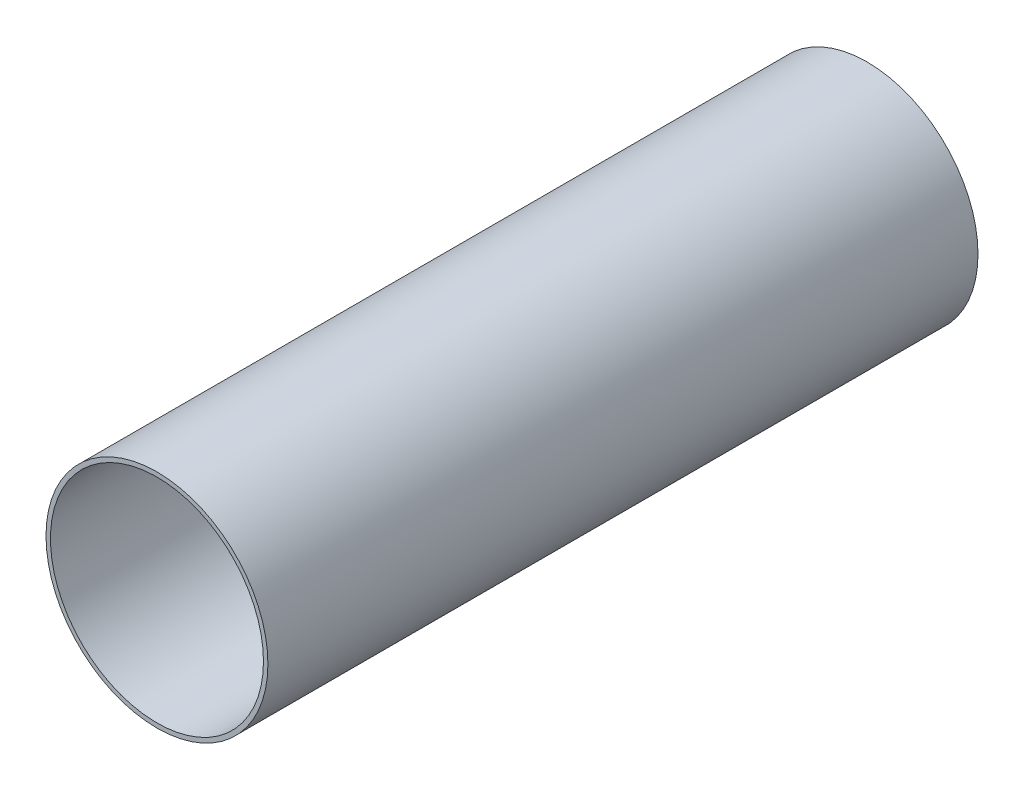
from build123d import *

# Parameters (mm, degrees)
ESQUISSE1_R        = 25
ESQUISSE1_R_2      = 24
BOSS_EXTRU_1_DEPTH = 160


with BuildPart() as part:
    # Esquisse1 → Boss.-Extru.1 (new body)
    with BuildSketch(Plane.XY):
        Circle(ESQUISSE1_R)
        Circle(ESQUISSE1_R_2, mode=Mode.SUBTRACT)
    extrude(amount=BOSS_EXTRU_1_DEPTH)


solid = part.part
